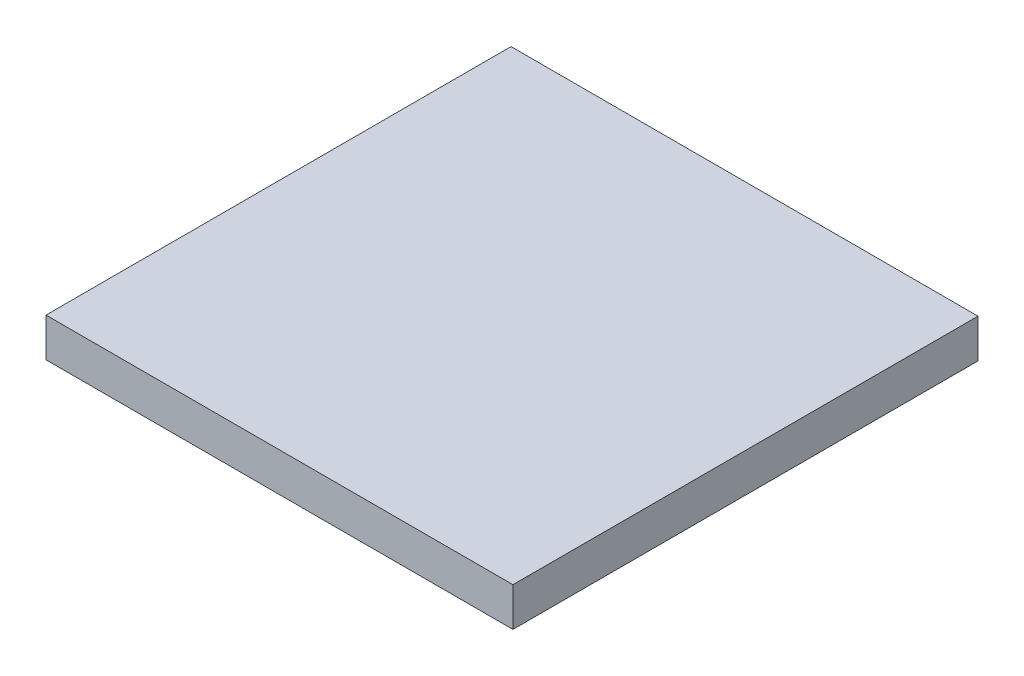
from build123d import *

# Parameters (mm, degrees)
SKETCH1_W           = 306.04968
SKETCH1_H           = 25.4
BOSS_EXTRUDE1_DEPTH = 304.8


with BuildPart() as part:
    # Sketch1 → Boss-Extrude1 (new body)
    with BuildSketch(Plane.XY):
        Rectangle(SKETCH1_W, SKETCH1_H)
    extrude(amount=-BOSS_EXTRUDE1_DEPTH)


solid = part.part
